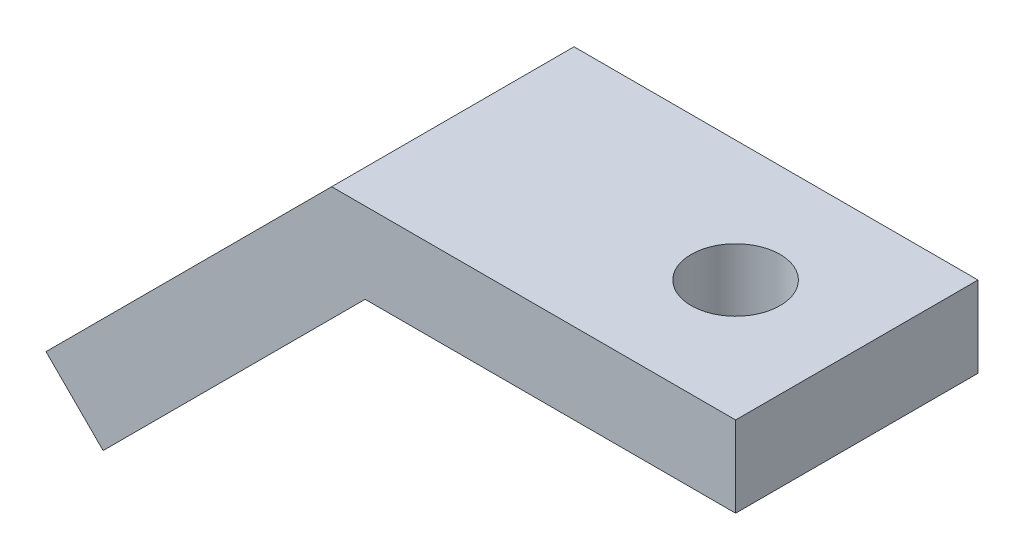
from build123d import *

# Parameters (mm, degrees)
BOSS_EXTRUDE1_DEPTH = 6
SKETCH2_R           = 1.1
CUT_EXTRUDE1_DEPTH  = 6
SKETCH3_R           = 1.1
CUT_EXTRUDE2_DEPTH  = 6


with BuildPart() as part:
    # Sketch1 → Boss-Extrude1 (new body)
    with BuildSketch(Plane.XY):
        Polygon((8.698883255, 4.390425939), (-1.301116745, 4.390425939), (-8.372184556, -2.680641873), (-6.957970994, -4.094855435), (-0.47268962, 2.390425939), (8.698883255, 2.390425939), align=None)
    extrude(amount=BOSS_EXTRUDE1_DEPTH)

    # Sketch2 → Cut-Extrude1 (cut)
    with BuildSketch(Plane(origin=(0, 4.390425939, 0), x_dir=(1, 0, 0), z_dir=(0, 1, 0))):
        with Locations(Location((5.698883255, -3, 0), (0, 0, 180))):
            Circle(SKETCH2_R)
    extrude(amount=-CUT_EXTRUDE1_DEPTH, mode=Mode.SUBTRACT)

    # Sketch3 → Cut-Extrude2 (cut)
    with BuildSketch(Plane(origin=(-2.845771342, 2.845771342, 0), x_dir=(0, 0, 1), z_dir=(-0.7071067811865489, 0.7071067811865461, 0))):
        with Locations(Location((3, -4.81552852, 0), (0, 0, 270))):
            Circle(SKETCH3_R)
    extrude(amount=-CUT_EXTRUDE2_DEPTH, mode=Mode.SUBTRACT)


solid = part.part
